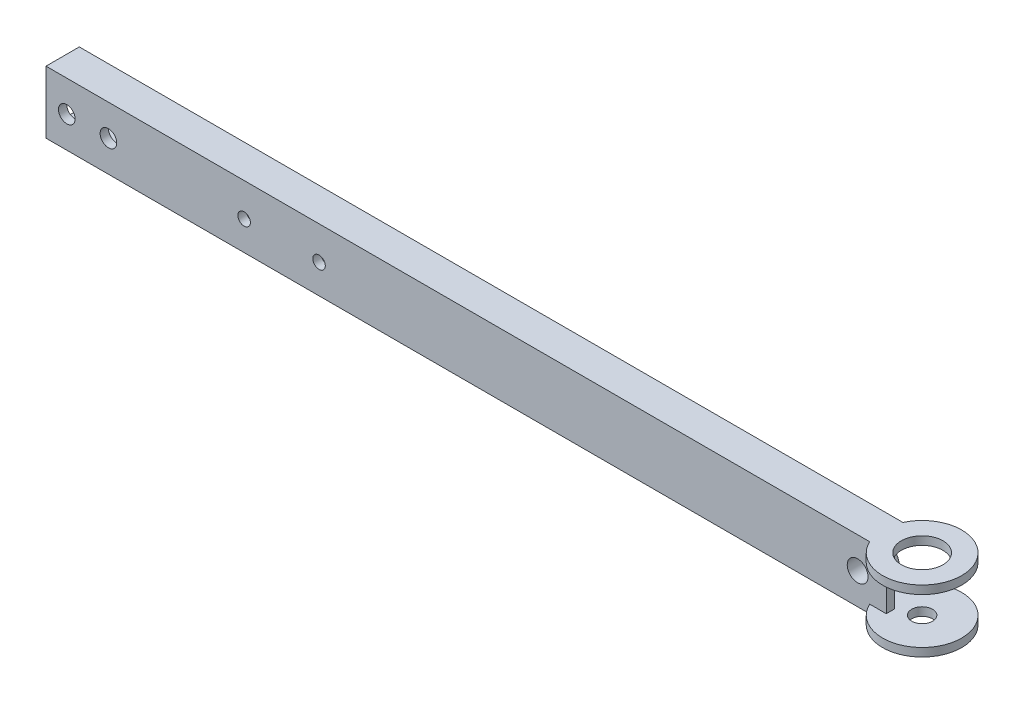
from build123d import *

# Parameters (mm, degrees)
SKETCH1_R                         = 2.5
BOSS_EXTRUDE3_DEPTH               = 2
SKETCH5_W                         = 2
SKETCH5_H                         = 11
BOSS_EXTRUDE4_DEPTH               = 197.88316
SKETCH6_R                         = 5
BOSS_EXTRUDE5_DEPTH               = 2
SKETCH8_W                         = 2
SKETCH8_H                         = 11
BOSS_EXTRUDE6_DEPTH               = 4
CUT_EXTRUDE8_REACH                = 209.363
SKETCH10_R                        = 2
SKETCH10_R_2                      = 1.5
SKETCH11_R                        = 4
SKETCH11_R_2                      = 2.5
BOSS_EXTRUDE7_DEPTH               = 4
CUT_EXTRUDE9_REACH                = 209.363
SKETCH12_R                        = 2.5
M3_5X0_6_TAPPED_HOLE2_D           = 2.9
M3_5X0_6_TAPPED_HOLE2_DEPTH       = 2
M3_5X0_6_TAPPED_HOLE2_CSINK_D     = 3.55
M3_5X0_6_TAPPED_HOLE2_CSINK_ANGLE = 90
M3_5X0_6_TAPPED_HOLE2_TIP         = 0.871247898
FILLET1_R                         = 1


with BuildPart() as part:
    # Sketch1 → Boss-Extrude3 (new body)
    with BuildSketch(Plane(origin=(0, 0, 0), x_dir=(1, 0, 0), z_dir=(0, 1, 0))):
        with BuildLine():
            Line((-206.5, 4), (-8.61684397, 4))
            ThreePointArc((-8.61684397, 4), (9.5, 0), (-8.61684397, -4))
            Line((-8.61684397, -4), (-206.5, -4))
            Line((-206.5, -4), (-206.5, 4))
        make_face()
        with Locations(Location((0, 0, 0), (0, 0, 270))):
            Circle(SKETCH1_R, mode=Mode.SUBTRACT)
    extrude(amount=BOSS_EXTRUDE3_DEPTH)

    # Sketch5 → Boss-Extrude4 (add)
    with BuildSketch(Plane.ZY.offset(206.5)):
        with Locations((3, 7.5)):
            Rectangle(SKETCH5_W, SKETCH5_H)
    extrude(amount=-BOSS_EXTRUDE4_DEPTH)


with BuildPart() as boss_extrude5_tool:
    # Sketch6 → Boss-Extrude5 (new body)
    with BuildSketch(Plane(origin=(0, 13, 0), x_dir=(1, 0, 0), z_dir=(0, 1, 0))):
        with BuildLine():
            Line((-206.5, 4), (-8.61684397, 4))
            ThreePointArc((-8.61684397, 4), (9.5, 0), (-8.61684397, -4))
            Line((-8.61684397, -4), (-206.5, -4))
            Line((-206.5, -4), (-206.5, 4))
        make_face()
        with Locations(Location((0, 0, 0), (0, 0, 270))):
            Circle(SKETCH6_R, mode=Mode.SUBTRACT)
    extrude(amount=BOSS_EXTRUDE5_DEPTH)


with BuildPart() as part_1:
    add(part.part)


with BuildPart() as part_2:
    # Boss-Extrude5: joined with boss_extrude5_tool
    add(part_1.part.fuse(boss_extrude5_tool.part, tol=0.00001))

    # Sketch8 → Boss-Extrude6 (add)
    with BuildSketch(Plane(origin=(-8.61684397, 0, 0), x_dir=(0, 0, -1), z_dir=(1, 0, 0))):
        with Locations((-3, 7.5)):
            Rectangle(SKETCH8_W, SKETCH8_H)
    extrude(amount=BOSS_EXTRUDE6_DEPTH)

    # Sketch10 → Cut-Extrude8 (cut, up to next)
    with BuildSketch(Plane(origin=(0, 0, 2), x_dir=(-1, 0, 0), z_dir=(0, 0, -1)), mode=Mode.PRIVATE) as cut_extrude8_sk1:
        with Locations((201.5, 7.5)):
            Circle(SKETCH10_R)
    cut_extrude8_tool1 = extrude(cut_extrude8_sk1.sketch, amount=-CUT_EXTRUDE8_REACH, mode=Mode.PRIVATE) & part_2.part
    # Sketch10 → Cut-Extrude8 (cut, up to next)
    with BuildSketch(Plane(origin=(0, 0, 2), x_dir=(-1, 0, 0), z_dir=(0, 0, -1)), mode=Mode.PRIVATE) as cut_extrude8_sk2:
        with Locations((191.5, 7.5)):
            Circle(SKETCH10_R)
    cut_extrude8_tool2 = extrude(cut_extrude8_sk2.sketch, amount=-CUT_EXTRUDE8_REACH, mode=Mode.PRIVATE) & part_2.part
    # Sketch10 → Cut-Extrude8 (cut, up to next)
    with BuildSketch(Plane(origin=(0, 0, 2), x_dir=(-1, 0, 0), z_dir=(0, 0, -1)), mode=Mode.PRIVATE) as cut_extrude8_sk3:
        with Locations((158.9, 7)):
            Circle(SKETCH10_R_2)
    cut_extrude8_tool3 = extrude(cut_extrude8_sk3.sketch, amount=-CUT_EXTRUDE8_REACH, mode=Mode.PRIVATE) & part_2.part
    # Sketch10 → Cut-Extrude8 (cut, up to next)
    with BuildSketch(Plane(origin=(0, 0, 2), x_dir=(-1, 0, 0), z_dir=(0, 0, -1)), mode=Mode.PRIVATE) as cut_extrude8_sk4:
        with Locations((140.9, 7)):
            Circle(SKETCH10_R_2)
    cut_extrude8_tool4 = extrude(cut_extrude8_sk4.sketch, amount=-CUT_EXTRUDE8_REACH, mode=Mode.PRIVATE) & part_2.part
    add(cut_extrude8_tool1.solids().sort_by_distance((-201.5, 7.5, 2))[0], mode=Mode.SUBTRACT)
    add(cut_extrude8_tool2.solids().sort_by_distance((-191.5, 7.5, 2))[0], mode=Mode.SUBTRACT)
    add(cut_extrude8_tool3.solids().sort_by_distance((-158.9, 7, 2))[0], mode=Mode.SUBTRACT)
    add(cut_extrude8_tool4.solids().sort_by_distance((-140.9, 7, 2))[0], mode=Mode.SUBTRACT)

    # Sketch11 → Boss-Extrude7 (add)
    with BuildSketch(Plane(origin=(0, 0, 2), x_dir=(-1, 0, 0), z_dir=(0, 0, -1))):
        with Locations((11.5, 7.5)):
            Circle(SKETCH11_R)
        with Locations((11.5, 7.5)):
            Circle(SKETCH11_R_2, mode=Mode.SUBTRACT)
    extrude(amount=BOSS_EXTRUDE7_DEPTH)

    # Sketch12 → Cut-Extrude9 (cut, up to next)
    with BuildSketch(Plane(origin=(0, 0, 2), x_dir=(-1, 0, 0), z_dir=(0, 0, -1)), mode=Mode.PRIVATE) as cut_extrude9_sk1:
        with Locations((11.5, 7.5)):
            Circle(SKETCH12_R)
    cut_extrude9_tool1 = extrude(cut_extrude9_sk1.sketch, amount=-CUT_EXTRUDE9_REACH, mode=Mode.PRIVATE) & part_2.part
    add(cut_extrude9_tool1.solids().sort_by_distance((-11.5, 7.5, 2))[0], mode=Mode.SUBTRACT)

    # M3.5x0.6 Tapped Hole2
    with Locations(Plane(origin=(0, 0, 0), x_dir=(-1, 0, 0), z_dir=(0, -1, 0))):
        with Locations((192, 0), (176, 0)):
            CounterSinkHole(M3_5X0_6_TAPPED_HOLE2_D / 2, M3_5X0_6_TAPPED_HOLE2_CSINK_D / 2, depth=M3_5X0_6_TAPPED_HOLE2_DEPTH, counter_sink_angle=M3_5X0_6_TAPPED_HOLE2_CSINK_ANGLE)
            with Locations((0, 0, -(M3_5X0_6_TAPPED_HOLE2_DEPTH + M3_5X0_6_TAPPED_HOLE2_TIP / 2))):  # 118° drill point
                Cone(0, M3_5X0_6_TAPPED_HOLE2_D / 2, M3_5X0_6_TAPPED_HOLE2_TIP, mode=Mode.SUBTRACT)

    # Fillet1
    fillet1_edges = [part_2.edges().sort_by_distance(p)[0] for p in [
        (-7.5, 7.5, 2),
    ]]
    fillet(fillet1_edges, radius=FILLET1_R)


solid = part_2.part
